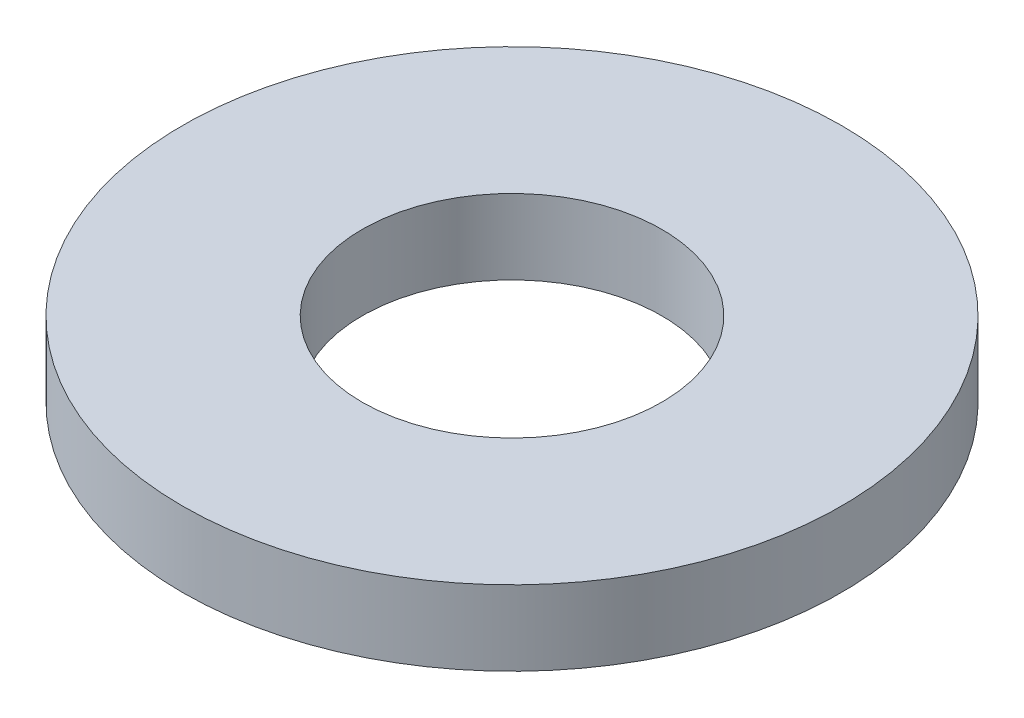
from build123d import *

# Parameters (mm, degrees)
SKETCH_1_R      = 22
SKETCH_1_R_2    = 10
EXTRUDE_1_DEPTH = 5


with BuildPart() as part:
    # Эскиз1 → Вытянуть1 (new body)
    with BuildSketch(Plane(origin=(0, 0, 0), x_dir=(1, 0, 0), z_dir=(0, 1, 0))):
        with Locations(Location((0, 0, 0), (0, 0, 270))):
            Circle(SKETCH_1_R)
        with Locations(Location((0, 0, 0), (0, 0, 270))):
            Circle(SKETCH_1_R_2, mode=Mode.SUBTRACT)
    extrude(amount=EXTRUDE_1_DEPTH)


solid = part.part
